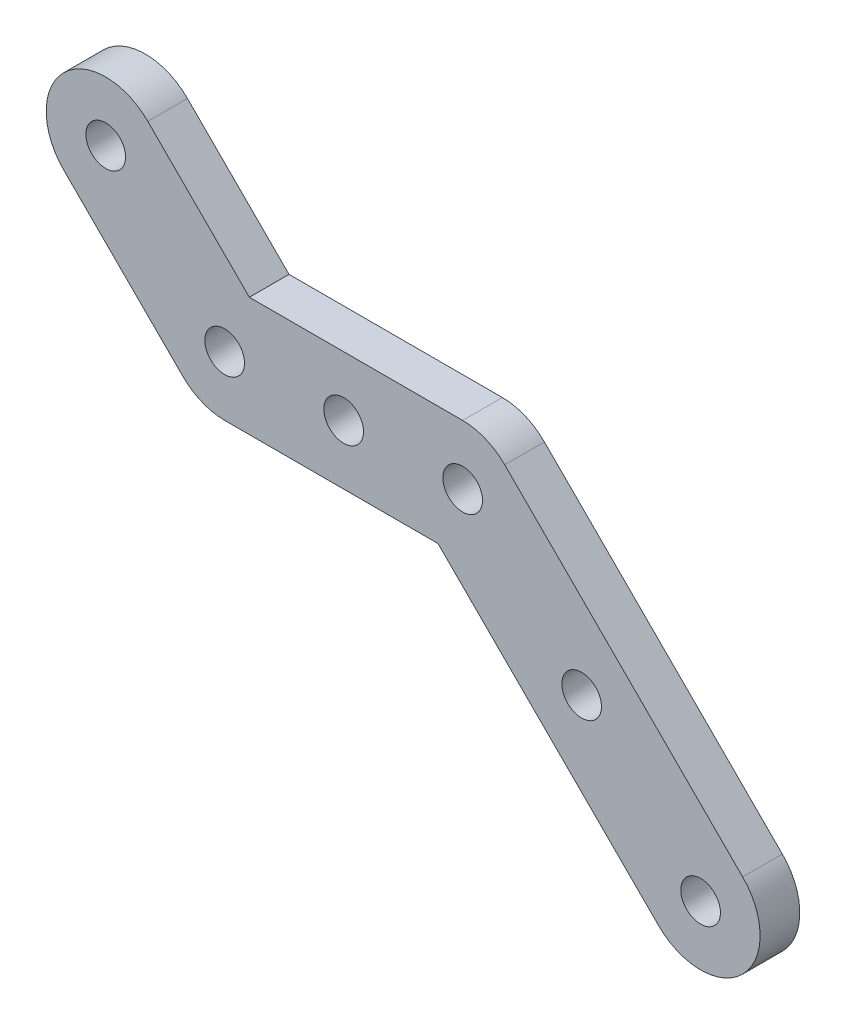
from build123d import *

# Parameters (mm, degrees)
MODEL_R                 = 1.5
SALIENTE_EXTRUIR1_DEPTH = 3


with BuildPart() as part:
    # Model → Saliente-Extruir1 (new body)
    with BuildSketch(Plane.XY):
        with BuildLine():
            Line((365.001663828, 201.955720999), (348.865624859, 201.955720999))
            Line((348.865624859, 201.955720999), (341.183644344, 209.637701515))
            ThreePointArc((341.183644344, 209.637701515), (334.819683313, 209.637701515), (334.819683313, 203.273740484))
            Line((334.819683313, 203.273740484), (343.819683313, 194.273740484))
            ThreePointArc((343.819683313, 194.273740484), (345.279588383, 193.298263103), (347.001663828, 192.955720999))
            Line((347.001663828, 192.955720999), (363.137702798, 192.955720999))
            Line((363.137702798, 192.955720999), (379.819683313, 176.273740484))
            ThreePointArc((379.819683313, 176.273740484), (386.183644344, 176.273740484), (386.183644344, 182.637701515))
            Line((386.183644344, 182.637701515), (368.183644344, 200.637701515))
            ThreePointArc((368.183644344, 200.637701515), (366.723739274, 201.613178895), (365.001663828, 201.955720999))
        make_face()
        with Locations((383.001663828, 179.455720999)):
            Circle(MODEL_R, mode=Mode.SUBTRACT)
        with Locations((374.001663828, 188.455720999)):
            Circle(MODEL_R, mode=Mode.SUBTRACT)
        with Locations((347.001663828, 197.455720999)):
            Circle(MODEL_R, mode=Mode.SUBTRACT)
        with Locations((356.001663828, 197.455720999)):
            Circle(MODEL_R, mode=Mode.SUBTRACT)
        with Locations((338.001663828, 206.455720999)):
            Circle(MODEL_R, mode=Mode.SUBTRACT)
        with Locations((365.001663828, 197.455720999)):
            Circle(MODEL_R, mode=Mode.SUBTRACT)
    extrude(amount=SALIENTE_EXTRUIR1_DEPTH)


solid = part.part
